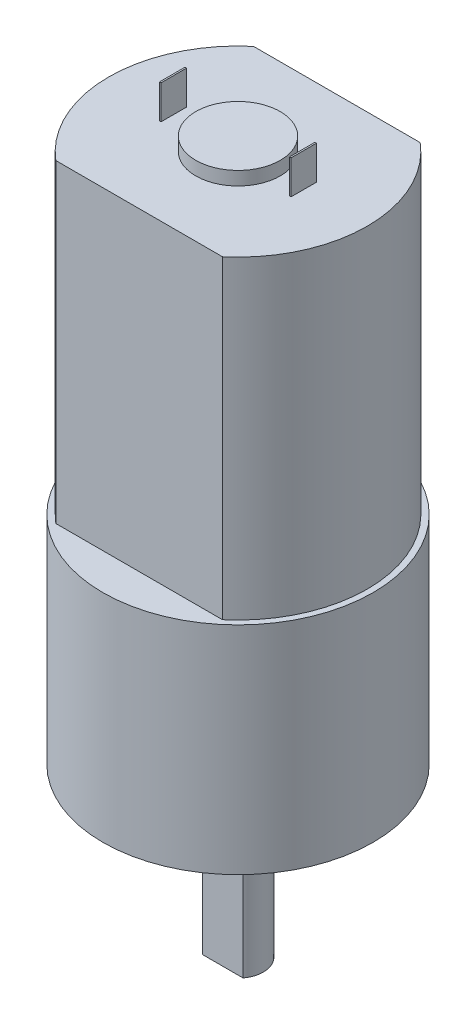
from build123d import *

# Parameters (mm, degrees)
SKETCH_1_R      = 8
EXTRUDE_1_DEPTH = 12.8
EXTRUDE_2_DEPTH = 18.6
SKETCH_3_R      = 2.5
EXTRUDE_3_DEPTH = 0.8
SKETCH_4_W      = 0.091344541
SKETCH_4_H      = 1.5
EXTRUDE_4_DEPTH = 2
SKETCH_5_R      = 3
EXTRUDE_5_DEPTH = 2.3
EXTRUDE_6_DEPTH = 7.6


with BuildPart() as part:
    # Эскиз1 → Бобышка-Вытянуть1 (new body)
    with BuildSketch(Plane(origin=(0, 0, 0), x_dir=(1, 0, 0), z_dir=(0, 1, 0))):
        with Locations(Location((0, 0, 0), (0, 0, 270))):
            Circle(SKETCH_1_R)
    extrude(amount=EXTRUDE_1_DEPTH)

    # Эскиз2 → Бобышка-Вытянуть2 (add)
    with BuildSketch(Plane(origin=(0, 12.8, 0), x_dir=(1, 0, 0), z_dir=(0, 1, 0))):
        with BuildLine():
            Line((-4.929503018, 5.85), (4.929503018, 5.85))
            ThreePointArc((4.929503018, 5.85), (7.65, 0), (4.929503018, -5.85))
            Line((4.929503018, -5.85), (-4.929503018, -5.85))
            ThreePointArc((-4.929503018, -5.85), (-7.65, 0), (-4.929503018, 5.85))
        make_face()
    extrude(amount=EXTRUDE_2_DEPTH)

    # Эскиз3 → Бобышка-Вытянуть3 (add)
    with BuildSketch(Plane(origin=(0, 31.4, 0), x_dir=(1, 0, 0), z_dir=(0, 1, 0))):
        with Locations(Location((0, 0, 0), (0, 0, 270))):
            Circle(SKETCH_3_R)
    extrude(amount=EXTRUDE_3_DEPTH)

    # Эскиз4 → Бобышка-Вытянуть4 (add)
    with BuildSketch(Plane(origin=(0, 31.4, 0), x_dir=(1, 0, 0), z_dir=(0, 1, 0))):
        with Locations((-3.845672271, 0)):
            Rectangle(SKETCH_4_W, SKETCH_4_H)
        with Locations((3.845672271, 0)):
            Rectangle(SKETCH_4_W, SKETCH_4_H)
    extrude(amount=EXTRUDE_4_DEPTH)

    # Эскиз5 → Бобышка-Вытянуть5 (add)
    with BuildSketch(Plane.XZ):
        with Locations(Location((0, 0, 0), (0, 0, 90))):
            Circle(SKETCH_5_R)
    extrude(amount=EXTRUDE_5_DEPTH)

    # Эскиз6 → Бобышка-Вытянуть6 (add)
    with BuildSketch(Plane.XZ.offset(2.3)):
        with BuildLine():
            Line((-1.2, 0.9), (1.2, 0.9))
            ThreePointArc((1.2, 0.9), (0, -1.5), (-1.2, 0.9))
        make_face()
    extrude(amount=EXTRUDE_6_DEPTH)


solid = part.part
